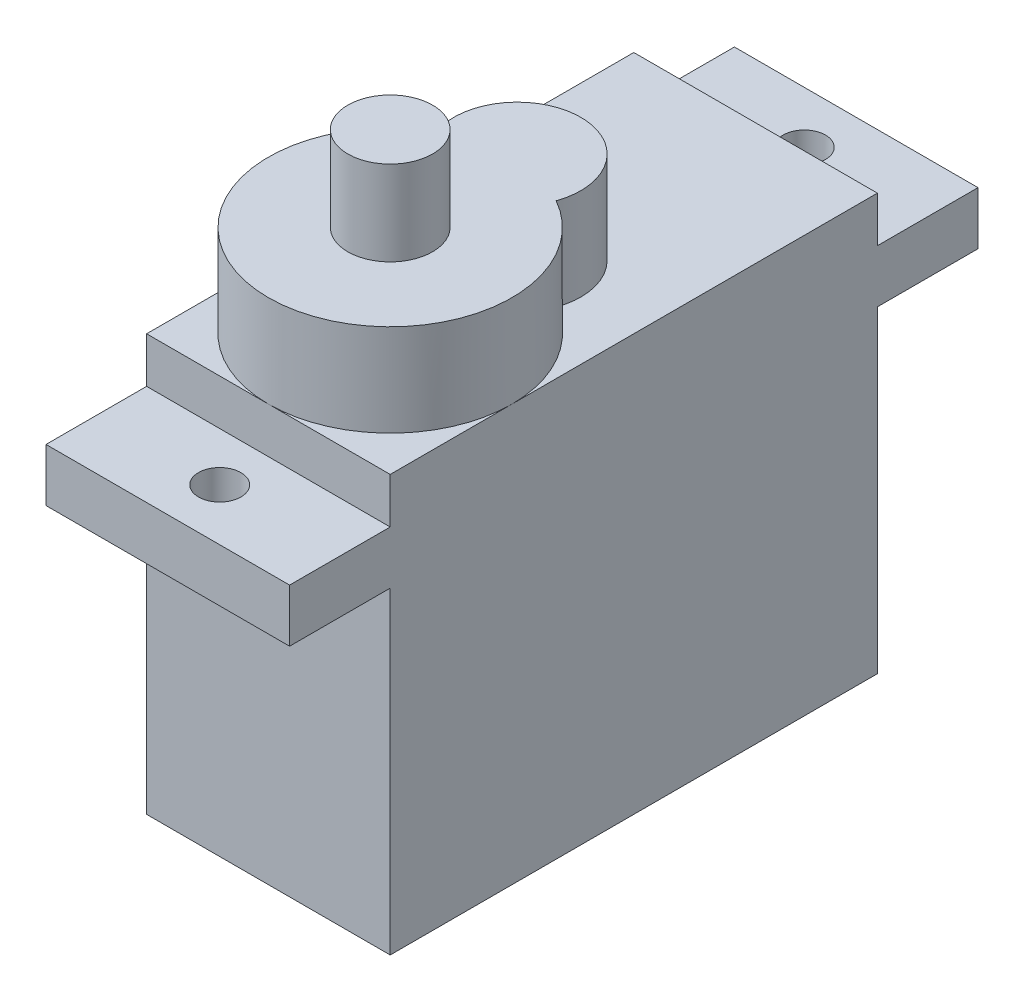
from build123d import *

# Parameters (mm, degrees)
EXTRUDE_1_DEPTH     = 11.5
EXTRUDE_2_DEPTH     = 4.35
SKETCH_3_R          = 2
EXTRUDE_3_DEPTH     = 4
SKETCH_4_R          = 1
CUT_EXTRUDE_1_DEPTH = 27.505895571


with BuildPart() as part:
    # 草圖1 → 填料-伸長1 (new body)
    with BuildSketch(Plane(origin=(0, 0, 0), x_dir=(0, 0, -1), z_dir=(1, 0, 0))):
        Polygon((11.5, 10), (16.25, 10), (16.25, 7.5), (11.5, 7.5), (11.5, -7.5), (-11.5, -7.5), (-11.5, 7.5), (-16.25, 7.5), (-16.25, 10), (-11.5, 10), (-11.5, 12.15), (11.5, 12.15), align=None)
    extrude(amount=EXTRUDE_1_DEPTH)

    # 草圖2 → 填料-伸長2 (add)
    with BuildSketch(Plane(origin=(0, 12.15, 0), x_dir=(1, 0, 0), z_dir=(0, 1, 0))):
        with BuildLine():
            ThreePointArc((2.919736843, -0.744791667), (5.75, -11.5), (8.580263157, -0.744791667))
            ThreePointArc((8.580263157, -0.744791667), (5.75, 3.25), (2.919736843, -0.744791667))
        make_face()
    extrude(amount=EXTRUDE_2_DEPTH)

    # 草圖3 → 填料-伸長3 (add)
    with BuildSketch(Plane(origin=(0, 16.5, 0), x_dir=(1, 0, 0), z_dir=(0, 1, 0))):
        with Locations(Location((5.75, -5.75, 0), (0, 0, 270))):
            Circle(SKETCH_3_R)
    extrude(amount=EXTRUDE_3_DEPTH)

    # 草圖4 → 除料-伸長1 (cut, through all)
    with BuildSketch(Plane(origin=(0, 10, 0), x_dir=(1, 0, 0), z_dir=(0, 1, 0))):
        with Locations(Location((5.75, -13.8, 0), (0, 0, 270))):
            Circle(SKETCH_4_R)
        with Locations(Location((5.75, 13.8, 0), (0, 0, 270))):
            Circle(SKETCH_4_R)
    extrude(amount=-CUT_EXTRUDE_1_DEPTH, mode=Mode.SUBTRACT)


solid = part.part
